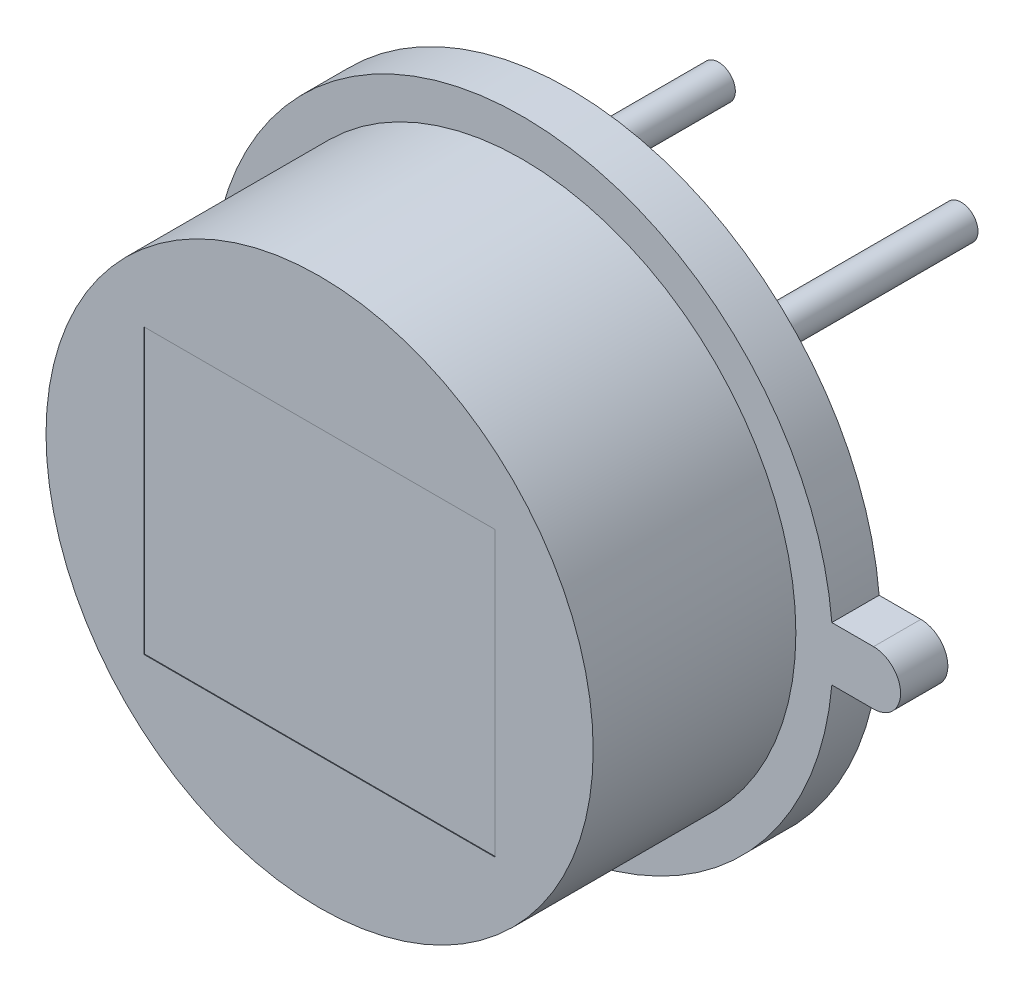
from build123d import *

# Parameters (mm, degrees)
EXTRUDE_1_DEPTH     = 0.7
SKETCH_2_R          = 4.05
EXTRUDE_2_DEPTH     = 3
SKETCH_3_W          = 5.2
SKETCH_3_H          = 4.2
CUT_EXTRUDE_1_DEPTH = 0.01
SKETCH_4_R          = 0.25
EXTRUDE_3_DEPTH     = 4


with BuildPart() as part:
    # Эскиз1 → Бобышка-Вытянуть1 (new body)
    with BuildSketch(Plane.XY):
        with BuildLine():
            Line((5.2, 0.4), (4.582575695, 0.4))
            ThreePointArc((4.582575695, 0.4), (-4.6, 0), (4.582575695, -0.4))
            Line((4.582575695, -0.4), (5.2, -0.4))
            ThreePointArc((5.2, -0.4), (5.6, 0), (5.2, 0.4))
        make_face()
    extrude(amount=EXTRUDE_1_DEPTH)

    # Эскиз2 → Бобышка-Вытянуть2 (add)
    with BuildSketch(Plane.XY.offset(0.7)):
        Circle(SKETCH_2_R)
    extrude(amount=EXTRUDE_2_DEPTH)

    # Эскиз3 → Вырез-Вытянуть1 (cut)
    with BuildSketch(Plane.XY.offset(3.7)):
        Rectangle(SKETCH_3_W, SKETCH_3_H)
    extrude(amount=-CUT_EXTRUDE_1_DEPTH, mode=Mode.SUBTRACT)

    # Эскиз4 → Бобышка-Вытянуть3 (add)
    with BuildSketch(Plane.XY):
        with Locations((1.796, 1.796)):
            Circle(SKETCH_4_R)
        with Locations((-1.796, 1.796)):
            Circle(SKETCH_4_R)
        with Locations((-1.796, -1.796)):
            Circle(SKETCH_4_R)
    extrude(amount=-EXTRUDE_3_DEPTH)


solid = part.part
